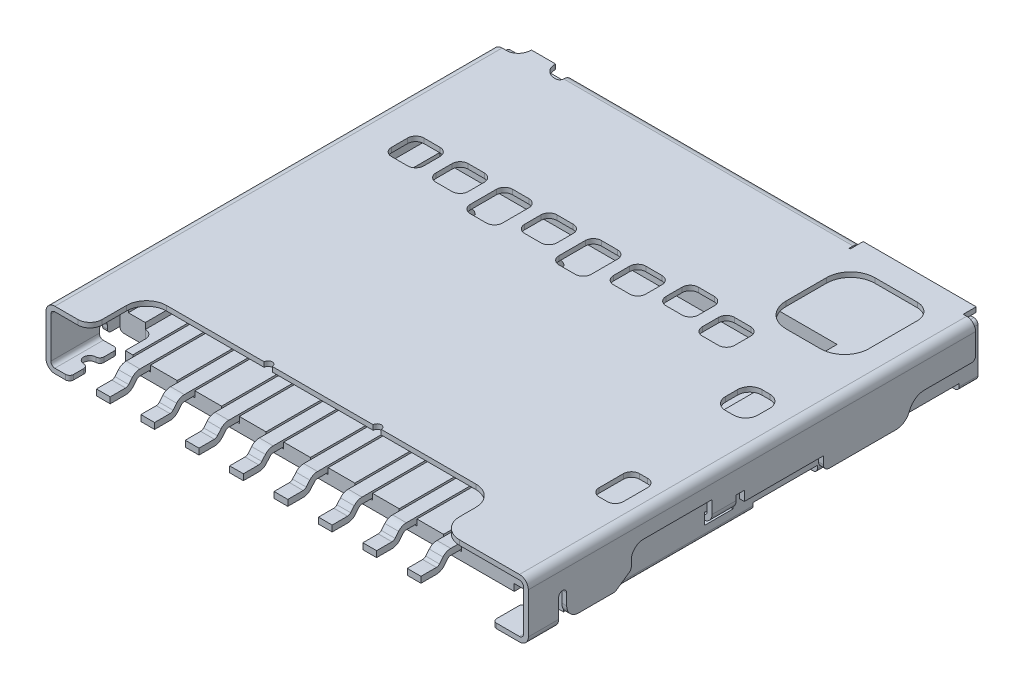
from build123d import *

# Parameters (mm, degrees)
BOSS_EXTRUDE1_DEPTH = 11.08
BOSS_EXTRUDE2_DEPTH = 1.2
CUT_EXTRUDE2_DEPTH  = 1.2
CUT_EXTRUDE3_DEPTH  = 1.2
BOSS_EXTRUDE3_DEPTH = 0.75
CUT_EXTRUDE4_DEPTH  = 0.75
CUT_EXTRUDE5_DEPTH  = 0.75
SKETCH9_W           = 2.8
SKETCH9_H           = 0.320000014
BOSS_EXTRUDE4_DEPTH = 0.12
BOSS_EXTRUDE5_DEPTH = 0.6
CUT_EXTRUDE6_DEPTH  = 0.75
FILLET1_R           = 0.1
BOSS_EXTRUDE6_DEPTH = 7.17
BOSS_EXTRUDE7_DEPTH = 1.2
CUT_EXTRUDE7_DEPTH  = 1.2
CUT_EXTRUDE8_DEPTH  = 1.2
CUT_EXTRUDE9_DEPTH  = 1.2
CUT_EXTRUDE10_DEPTH = 1.2
BOSS_EXTRUDE8_DEPTH = 10.27
SKETCH19_W          = 0.7
SKETCH19_H          = 0.281131807
CUT_EXTRUDE12_DEPTH = 0.5
FILLET2_R           = 0.1
CUT_EXTRUDE13_DEPTH = 0.06
CUT_EXTRUDE14_DEPTH = 0.13
SKETCH22_W          = 2.605000011
SKETCH22_H          = 1.079999998
SKETCH22_W_2        = 2.565
CUT_EXTRUDE15_DEPTH = 0.15
SKETCH23_W          = 1.22
SKETCH23_H          = 0.25
CUT_EXTRUDE16_DEPTH = 0.17
CUT_EXTRUDE17_REACH = 14.95
CUT_EXTRUDE18_DEPTH = 8
SKETCH26_W          = 0.44
SKETCH26_H          = 0.15
CUT_EXTRUDE19_DEPTH = 4.22
BOSS_EXTRUDE9_DEPTH = 0.34
LPATTERN2_COUNT     = 8
LPATTERN2_PITCH     = 1.1


with BuildPart() as part:
    # Sketch1 → Boss-Extrude1 (new body)
    with BuildSketch(Plane.XY):
        with BuildLine():
            Line((4.275, 0.605), (5.755, 0.605))
            ThreePointArc((5.755, 0.605), (5.825710678, 0.575710678), (5.855, 0.505))
            Line((5.855, 0.505), (5.855, -0.505))
            Line((5.855, -0.505), (5.855, -0.614999996))
            Line((5.855, -0.614999996), (5.975, -0.614999996))
            Line((5.975, -0.614999996), (5.975, -0.505))
            Line((5.975, -0.505), (5.975, 0.505))
            ThreePointArc((5.975, 0.505), (5.910563492, 0.660563492), (5.755, 0.725))
            Line((5.755, 0.725), (4.275, 0.725))
            Line((4.275, 0.725), (3.775, 0.725))
            Line((3.775, 0.725), (3.275, 0.725))
            Line((3.275, 0.725), (0.930302692, 0.725))
            Line((0.930302692, 0.725), (0.830302692, 0.725))
            Line((0.830302692, 0.725), (0.730302692, 0.725))
            Line((0.730302692, 0.725), (-1.769697308, 0.725))
            Line((-1.769697308, 0.725), (-1.869697308, 0.725))
            Line((-1.869697308, 0.725), (-1.969697308, 0.725))
            Line((-1.969697308, 0.725), (-4.385, 0.725))
            Line((-4.385, 0.725), (-4.885, 0.725))
            Line((-4.885, 0.725), (-5.185, 0.725))
            Line((-5.185, 0.725), (-5.755, 0.725))
            ThreePointArc((-5.755, 0.725), (-5.910563492, 0.660563492), (-5.975, 0.505))
            Line((-5.975, 0.505), (-5.975, -0.505))
            Line((-5.975, -0.505), (-5.975, -0.615))
            Line((-5.975, -0.615), (-5.855, -0.615))
            Line((-5.855, -0.615), (-5.855, -0.505))
            Line((-5.855, -0.505), (-5.855, 0.505))
            ThreePointArc((-5.855, 0.505), (-5.825710678, 0.575710678), (-5.755, 0.605))
            Line((-5.755, 0.605), (-5.185, 0.605))
            Line((-5.185, 0.605), (-4.885, 0.605))
            Line((-4.885, 0.605), (-4.385, 0.605))
            Line((-4.385, 0.605), (-1.969697308, 0.605))
            Line((-1.969697308, 0.605), (-1.869697308, 0.605))
            Line((-1.869697308, 0.605), (-1.769697308, 0.605))
            Line((-1.769697308, 0.605), (0.730302692, 0.605))
            Line((0.730302692, 0.605), (0.830302692, 0.605))
            Line((0.830302692, 0.605), (0.930302692, 0.605))
            Line((0.930302692, 0.605), (3.275, 0.605))
            Line((3.275, 0.605), (3.775, 0.605))
            Line((3.775, 0.605), (4.275, 0.605))
        make_face()
    extrude(amount=-BOSS_EXTRUDE1_DEPTH)

    # Sketch3 → Boss-Extrude2 (add)
    with BuildSketch(Plane.XY):
        with BuildLine():
            Line((-5.489999995, -0.725), (-5.389999995, -0.725))
            Line((-5.389999995, -0.725), (-5.389999995, -0.605))
            Line((-5.389999995, -0.605), (-5.489999995, -0.605))
            Line((-5.489999995, -0.605), (-5.755, -0.605))
            ThreePointArc((-5.755, -0.605), (-5.825710678, -0.575710678), (-5.855, -0.505))
            Line((-5.855, -0.505), (-5.975, -0.505))
            ThreePointArc((-5.975, -0.505), (-5.910563492, -0.660563492), (-5.755, -0.725))
            Line((-5.755, -0.725), (-5.489999995, -0.725))
        make_face()
    extrude(amount=-BOSS_EXTRUDE2_DEPTH)

    # Sketch4 → Cut-Extrude2 (cut)
    with BuildSketch(Plane.ZY.offset(5.975)):
        with BuildLine():
            Line((-1.2, -0.435), (-1.2, -0.505))
            Line((-1.2, -0.505), (-1.2, -0.745695332))
            Line((-1.2, -0.745695332), (-1.5, -0.745695332))
            Line((-1.5, -0.745695332), (-1.5, -0.615))
            ThreePointArc((-1.5, -0.615), (-1.429289322, -0.585710678), (-1.4, -0.515))
            Line((-1.4, -0.515), (-1.4, -0.435))
            ThreePointArc((-1.4, -0.435), (-1.3, -0.335), (-1.2, -0.435))
        make_face()
    extrude(amount=-CUT_EXTRUDE2_DEPTH, mode=Mode.SUBTRACT)

    # Sketch5 → Cut-Extrude3 (cut)
    with BuildSketch(Plane.XY):
        with BuildLine():
            Line((-5.975, -0.505), (-5.975, -0.725))
            Line((-5.975, -0.725), (-5.755, -0.725))
            ThreePointArc((-5.755, -0.725), (-5.910563492, -0.660563492), (-5.975, -0.505))
        make_face()
    extrude(amount=-CUT_EXTRUDE3_DEPTH, mode=Mode.SUBTRACT)

    # Sketch6 → Boss-Extrude3 (add)
    with BuildSketch(Plane.XY):
        with BuildLine():
            Line((5.755, -0.605), (5.190000003, -0.605))
            Line((5.190000003, -0.605), (5.090000003, -0.605))
            Line((5.090000003, -0.605), (5.090000003, -0.725))
            Line((5.090000003, -0.725), (5.190000003, -0.725))
            Line((5.190000003, -0.725), (5.755, -0.725))
            ThreePointArc((5.755, -0.725), (5.910563492, -0.660563492), (5.975, -0.505))
            Line((5.975, -0.505), (5.855, -0.505))
            ThreePointArc((5.855, -0.505), (5.825710678, -0.575710678), (5.755, -0.605))
        make_face()
    extrude(amount=-BOSS_EXTRUDE3_DEPTH)

    # Sketch7 → Cut-Extrude4 (cut)
    with BuildSketch(Plane(origin=(5.975, 0, 0), x_dir=(0, 0, -1), z_dir=(1, 0, 0))):
        with BuildLine():
            Line((0.75, -0.725), (0.75, -0.505))
            Line((0.75, -0.505), (0.75, -0.034999996))
            ThreePointArc((0.75, -0.034999996), (0.85, 0.065000004), (0.95, -0.034999996))
            Line((0.95, -0.034999996), (0.95, -0.314999996))
            ThreePointArc((0.95, -0.314999996), (1.037867966, -0.52713203), (1.25, -0.614999996))
            Line((1.25, -0.614999996), (2.118477758, -0.614999996))
            ThreePointArc((2.118477758, -0.614999996), (2.148541697, -0.610373785), (2.175823993, -0.596923188))
            Line((2.175823993, -0.596923188), (2.507346216, -0.364857632))
            ThreePointArc((2.507346216, -0.364857632), (2.538697849, -0.329115478), (2.549999981, -0.28293444))
            Line((2.549999981, -0.28293444), (2.549999981, -0.134999995))
            ThreePointArc((2.549999981, -0.134999995), (2.637867947, 0.077132039), (2.849999981, 0.165000005))
            Line((2.849999981, 0.165000005), (4.549999981, 0.165000005))
            Line((4.549999981, 0.165000005), (4.549999981, -0.155))
            Line((4.549999981, -0.155), (5.149999981, -0.155))
            Line((5.149999981, -0.155), (5.149999981, -0.034999995))
            Line((5.149999981, -0.034999995), (5.349999981, -0.034999995))
            Line((5.349999981, -0.034999995), (5.349999981, -0.274999996))
            Line((5.349999981, -0.274999996), (7.310000033, -0.274999996))
            Line((7.310000033, -0.274999996), (7.310000033, -0.464999996))
            ThreePointArc((7.310000033, -0.464999996), (7.353934016, -0.571066013), (7.460000033, -0.614999996))
            Line((7.460000033, -0.614999996), (9.109999974, -0.614999996))
            ThreePointArc((9.109999974, -0.614999996), (9.312072569, -0.550773799), (9.439983139, -0.381666662))
            ThreePointArc((9.439983139, -0.381666662), (9.586166648, -0.188401363), (9.817106756, -0.114999996))
            Line((9.817106756, -0.114999996), (10.979999986, -0.114999996))
            ThreePointArc((10.979999986, -0.114999996), (11.050710664, -0.085710674), (11.079999986, -0.014999996))
            Line((11.079999986, -0.014999996), (11.079999986, -0.725))
            Line((11.079999986, -0.725), (0.75, -0.725))
        make_face()
    extrude(amount=-CUT_EXTRUDE4_DEPTH, mode=Mode.SUBTRACT)

    # Sketch8 → Cut-Extrude5 (cut)
    with BuildSketch(Plane.XY):
        with BuildLine():
            Line((5.975, -0.505), (5.975, -0.725))
            Line((5.975, -0.725), (5.755, -0.725))
            ThreePointArc((5.755, -0.725), (5.910563492, -0.660563492), (5.975, -0.505))
        make_face()
    extrude(amount=-CUT_EXTRUDE5_DEPTH, mode=Mode.SUBTRACT)

    # Sketch9 → Boss-Extrude4 (add)
    with BuildSketch(Plane(origin=(0, 0.725, 0), x_dir=(1, 0, 0), z_dir=(0, 1, 0))):
        with BuildLine():
            Line((2.84, 11.08), (2.84, 11.18))
            Line((2.84, 11.18), (-4.33, 11.18))
            ThreePointArc((-4.33, 11.18), (-4.359289322, 11.109289322), (-4.43, 11.08))
            Line((-4.43, 11.08), (2.84, 11.08))
        make_face()
        with BuildLine():
            Line((-4.75, 11.38), (-4.75, 11.4))
            Line((-4.75, 11.4), (-5.35, 11.4))
            Line((-5.35, 11.4), (-5.35, 11.38))
            ThreePointArc((-5.35, 11.38), (-5.437867966, 11.167867966), (-5.65, 11.08))
            Line((-5.65, 11.08), (-4.45, 11.08))
            ThreePointArc((-4.45, 11.08), (-4.662132034, 11.167867966), (-4.75, 11.38))
        make_face()
        with Locations((4.27, 11.240000007)):
            Rectangle(SKETCH9_W, SKETCH9_H)
    extrude(amount=-BOSS_EXTRUDE4_DEPTH)

    # Sketch10 → Boss-Extrude5 (add)
    with BuildSketch(Plane.XY.offset(-4.549999981)):
        with BuildLine():
            Line((5.755, -0.255), (5.474999999, -0.255))
            Line((5.474999999, -0.255), (5.474999999, -0.375))
            Line((5.474999999, -0.375), (5.755, -0.375))
            ThreePointArc((5.755, -0.375), (5.910563492, -0.310563492), (5.975, -0.155))
            Line((5.975, -0.155), (5.855, -0.155))
            ThreePointArc((5.855, -0.155), (5.825710678, -0.225710678), (5.755, -0.255))
        make_face()
    extrude(amount=-BOSS_EXTRUDE5_DEPTH)

    # Sketch11 → Cut-Extrude6 (cut)
    with BuildSketch(Plane.XZ.offset(0.725)):
        with BuildLine():
            Line((-5.389999995, -1.1), (-5.389999995, -0.85))
            ThreePointArc((-5.389999995, -0.85), (-5.41928931, -0.779289329), (-5.489999975, -0.75))
            ThreePointArc((-5.489999975, -0.75), (-5.596066005, -0.706066024), (-5.639999995, -0.6))
            ThreePointArc((-5.639999995, -0.6), (-5.596066012, -0.493933983), (-5.489999995, -0.45))
            ThreePointArc((-5.489999995, -0.45), (-5.419289317, -0.420710678), (-5.389999995, -0.35))
            Line((-5.389999995, -0.35), (-5.389999995, -0.1))
            ThreePointArc((-5.389999995, -0.1), (-5.419289317, -0.029289322), (-5.489999995, 0))
            Line((-5.489999995, 0), (-5.335838017, 0))
            Line((-5.335838017, 0), (-5.335838017, -1.2))
            Line((-5.335838017, -1.2), (-5.489999995, -1.2))
            ThreePointArc((-5.489999995, -1.2), (-5.419289317, -1.170710678), (-5.389999995, -1.1))
        make_face()
    extrude(amount=-CUT_EXTRUDE6_DEPTH, mode=Mode.SUBTRACT)

    # Fillet1
    fillet1_edges = [part.edges().sort_by_distance(p)[0] for p in [
        (5.090000003, -0.665, -0.75),
        (5.090000003, -0.665, 0),
    ]]
    fillet(fillet1_edges, radius=FILLET1_R)

    # Sketch12 → Boss-Extrude6 (add)
    with BuildSketch(Plane(origin=(2.84, 0, 0), x_dir=(0, 0, -1), z_dir=(1, 0, 0))):
        with BuildLine():
            Line((11.280000014, -0.614999997), (11.400000014, -0.614999997))
            Line((11.400000014, -0.614999997), (11.400000014, -0.505))
            Line((11.400000014, -0.505), (11.400000014, 0.505))
            ThreePointArc((11.400000014, 0.505), (11.335563506, 0.660563492), (11.180000014, 0.725))
            Line((11.180000014, 0.725), (11.180000014, 0.605))
            ThreePointArc((11.180000014, 0.605), (11.250710692, 0.575710678), (11.280000014, 0.505))
            Line((11.280000014, 0.505), (11.280000014, -0.505))
            Line((11.280000014, -0.505), (11.280000014, -0.614999997))
        make_face()
    extrude(amount=-BOSS_EXTRUDE6_DEPTH)

    # Sketch13 → Boss-Extrude7 (add)
    with BuildSketch(Plane(origin=(2.84, 0, 0), x_dir=(0, 0, -1), z_dir=(1, 0, 0))):
        with BuildLine():
            Line((10.700016189, -0.605), (10.700016189, -0.725))
            Line((10.700016189, -0.725), (10.800016189, -0.725))
            Line((10.800016189, -0.725), (11.180016187, -0.725))
            ThreePointArc((11.180016187, -0.725), (11.335579679, -0.660563492), (11.400016187, -0.505))
            Line((11.400016187, -0.505), (11.280016187, -0.505))
            ThreePointArc((11.280016187, -0.505), (11.250726865, -0.575710678), (11.180016187, -0.605))
            Line((11.180016187, -0.605), (10.800016189, -0.605))
            Line((10.800016189, -0.605), (10.700016189, -0.605))
        make_face()
    boss_extrude7 = extrude(amount=-BOSS_EXTRUDE7_DEPTH)

    # Sketch14 → Cut-Extrude7 (cut)
    with BuildSketch(Plane(origin=(2.84, 0, 0), x_dir=(0, 0, -1), z_dir=(1, 0, 0))):
        with BuildLine():
            Line((11.400000014, -0.725), (11.400000014, -0.614999997))
            Line((11.400000014, -0.614999997), (11.370541778, -0.614999997))
            ThreePointArc((11.370541778, -0.614999997), (11.290016189, -0.695525588), (11.180016187, -0.725))
            Line((11.180016187, -0.725), (11.400000014, -0.725))
        make_face()
        with BuildLine():
            Line((11.400000014, -0.614999997), (11.400000014, -0.507667555))
            ThreePointArc((11.400000014, -0.507667555), (11.392170751, -0.563227495), (11.370541778, -0.614999997))
            Line((11.370541778, -0.614999997), (11.400000014, -0.614999997))
        make_face()
    cut_extrude7 = extrude(amount=-CUT_EXTRUDE7_DEPTH, mode=Mode.SUBTRACT)

    # Sketch15 → Cut-Extrude8 (cut)
    with BuildSketch(Plane.XZ.offset(0.725)):
        with BuildLine():
            Line((2.74, -10.700000016), (2.49, -10.700000016))
            ThreePointArc((2.49, -10.700000016), (2.419289322, -10.729289338), (2.39, -10.800000016))
            Line((2.39, -10.800000016), (2.39, -10.850000016))
            ThreePointArc((2.39, -10.850000016), (2.346066017, -10.956066033), (2.24, -11.000000016))
            ThreePointArc((2.24, -11.000000016), (2.133933983, -10.956066033), (2.09, -10.850000016))
            Line((2.09, -10.850000016), (2.09, -10.800000016))
            ThreePointArc((2.09, -10.800000016), (2.060710678, -10.729289338), (1.99, -10.700000016))
            Line((1.99, -10.700000016), (1.74, -10.700000016))
            ThreePointArc((1.74, -10.700000016), (1.669289322, -10.729289338), (1.64, -10.800000016))
            Line((1.64, -10.800000016), (1.64, -10.618683905))
            Line((1.64, -10.618683905), (2.84, -10.618683905))
            Line((2.84, -10.618683905), (2.84, -10.800000016))
            ThreePointArc((2.84, -10.800000016), (2.810710678, -10.729289338), (2.74, -10.700000016))
        make_face()
    cut_extrude8 = extrude(amount=-CUT_EXTRUDE8_DEPTH, mode=Mode.SUBTRACT)

    # Mirror1: Boss-Extrude7, Cut-Extrude7, Cut-Extrude8 across plane
    add(boss_extrude7.mirror(Plane(origin=(-0.745, 0, 0), x_dir=(0, 0, 1), z_dir=(1, 0, 0))))
    add(cut_extrude7.mirror(Plane(origin=(-0.745, 0, 0), x_dir=(0, 0, 1), z_dir=(1, 0, 0))), mode=Mode.SUBTRACT)
    add(cut_extrude8.mirror(Plane(origin=(-0.745, 0, 0), x_dir=(0, 0, 1), z_dir=(1, 0, 0))), mode=Mode.SUBTRACT)

    # Sketch16 → Cut-Extrude9 (cut)
    with BuildSketch(Plane(origin=(0, 0, -11.400000014), x_dir=(-1, 0, 0), z_dir=(0, 0, -1))):
        with BuildLine():
            Line((-1.64, -0.725), (-1.64, -0.505))
            Line((-1.64, -0.505), (-1.64, 0.105000003))
            Line((-1.64, 0.105000003), (-0.755, 0.105000003))
            Line((-0.755, 0.105000003), (-0.755, -0.414999997))
            ThreePointArc((-0.755, -0.414999997), (-0.696421356, -0.556421353), (-0.555, -0.614999997))
            Line((-0.555, -0.614999997), (2.045, -0.614999997))
            ThreePointArc((2.045, -0.614999997), (2.186421356, -0.556421353), (2.245, -0.414999997))
            Line((2.245, -0.414999997), (2.245, 0.105000003))
            Line((2.245, 0.105000003), (3.13, 0.105000003))
            Line((3.13, 0.105000003), (3.13, -0.505))
            Line((3.13, -0.505), (3.13, -0.725))
            Line((3.13, -0.725), (-1.64, -0.725))
        make_face()
    extrude(amount=-CUT_EXTRUDE9_DEPTH, mode=Mode.SUBTRACT)

    # Sketch17 → Cut-Extrude10 (cut)
    with BuildSketch(Plane(origin=(0, 0.725, 0), x_dir=(1, 0, 0), z_dir=(0, 1, 0))):
        with BuildLine():
            Line((-4.885, 0.3), (-4.885, 0.9))
            ThreePointArc((-4.885, 0.9), (-4.738553391, 1.253553391), (-4.385, 1.4))
            Line((-4.385, 1.4), (-1.969697308, 1.4))
            ThreePointArc((-1.969697308, 1.4), (-1.940407986, 1.470710678), (-1.869697308, 1.5))
            ThreePointArc((-1.869697308, 1.5), (-1.79898663, 1.470710678), (-1.769697308, 1.4))
            Line((-1.769697308, 1.4), (0.730302692, 1.4))
            ThreePointArc((0.730302692, 1.4), (0.759592014, 1.470710678), (0.830302692, 1.5))
            ThreePointArc((0.830302692, 1.5), (0.90101337, 1.470710678), (0.930302692, 1.4))
            Line((0.930302692, 1.4), (3.275, 1.4))
            ThreePointArc((3.275, 1.4), (3.628553391, 1.253553391), (3.775, 0.9))
            Line((3.775, 0.9), (3.775, 0.5))
            ThreePointArc((3.775, 0.5), (3.921446609, 0.146446609), (4.275, 0))
            Line((4.275, 0), (-5.185, 0))
            ThreePointArc((-5.185, 0), (-4.972867966, 0.087867966), (-4.885, 0.3))
        make_face()
        with BuildLine():
            Line((1.304999989, 7.58000003), (1.304999989, 7.98000003))
            ThreePointArc((1.304999989, 7.98000003), (1.246421345, 8.121421387), (1.104999989, 8.18000003))
            Line((1.104999989, 8.18000003), (0.704999989, 8.18000003))
            ThreePointArc((0.704999989, 8.18000003), (0.563578633, 8.121421387), (0.504999989, 7.98000003))
            Line((0.504999989, 7.98000003), (0.504999989, 7.58000003))
            ThreePointArc((0.504999989, 7.58000003), (0.563578633, 7.438578674), (0.704999989, 7.38000003))
            Line((0.704999989, 7.38000003), (1.104999989, 7.38000003))
            ThreePointArc((1.104999989, 7.38000003), (1.246421345, 7.438578674), (1.304999989, 7.58000003))
        make_face()
        with BuildLine():
            Line((0.004999989, 8.18000003), (-0.395000011, 8.18000003))
            ThreePointArc((-0.395000011, 8.18000003), (-0.536421367, 8.121421387), (-0.595000011, 7.98000003))
            Line((-0.595000011, 7.98000003), (-0.595000011, 7.33000003))
            ThreePointArc((-0.595000011, 7.33000003), (-0.536421367, 7.188578674), (-0.395000011, 7.13000003))
            Line((-0.395000011, 7.13000003), (0.004999989, 7.13000003))
            ThreePointArc((0.004999989, 7.13000003), (0.146421345, 7.188578674), (0.204999989, 7.33000003))
            Line((0.204999989, 7.33000003), (0.204999989, 7.98000003))
            ThreePointArc((0.204999989, 7.98000003), (0.146421345, 8.121421387), (0.004999989, 8.18000003))
        make_face()
        with BuildLine():
            Line((2.404999989, 7.780000046), (2.404999989, 8.180000046))
            ThreePointArc((2.404999989, 8.180000046), (2.346421345, 8.321421402), (2.204999989, 8.380000046))
            Line((2.204999989, 8.380000046), (1.804999989, 8.380000046))
            ThreePointArc((1.804999989, 8.380000046), (1.663578633, 8.321421402), (1.604999989, 8.180000046))
            Line((1.604999989, 8.180000046), (1.604999989, 7.780000046))
            ThreePointArc((1.604999989, 7.780000046), (1.663578633, 7.63857869), (1.804999989, 7.580000046))
            Line((1.804999989, 7.580000046), (2.204999989, 7.580000046))
            ThreePointArc((2.204999989, 7.580000046), (2.346421345, 7.63857869), (2.404999989, 7.780000046))
        make_face()
        with BuildLine():
            Line((3.304999989, 8.18000003), (2.904999989, 8.18000003))
            ThreePointArc((2.904999989, 8.18000003), (2.763578633, 8.121421387), (2.704999989, 7.98000003))
            Line((2.704999989, 7.98000003), (2.704999989, 7.58000003))
            ThreePointArc((2.704999989, 7.58000003), (2.763578633, 7.438578674), (2.904999989, 7.38000003))
            Line((2.904999989, 7.38000003), (3.304999989, 7.38000003))
            ThreePointArc((3.304999989, 7.38000003), (3.446421345, 7.438578674), (3.504999989, 7.58000003))
            Line((3.504999989, 7.58000003), (3.504999989, 7.98000003))
            ThreePointArc((3.504999989, 7.98000003), (3.446421345, 8.121421387), (3.304999989, 8.18000003))
        make_face()
        with BuildLine():
            Line((5.24, 9.17), (5.24, 10.37))
            ThreePointArc((5.24, 10.37), (5.122842712, 10.652842712), (4.84, 10.77))
            Line((4.84, 10.77), (3.79, 10.77))
            ThreePointArc((3.79, 10.77), (3.365735931, 10.594264069), (3.19, 10.17))
            Line((3.19, 10.17), (3.19, 9.17))
            ThreePointArc((3.19, 9.17), (3.365735931, 8.745735931), (3.79, 8.57))
            Line((3.79, 8.57), (4.64, 8.57))
            ThreePointArc((4.64, 8.57), (5.064264069, 8.745735931), (5.24, 9.17))
        make_face()
        with BuildLine():
            Line((4.79, 6.07), (4.99, 6.07))
            ThreePointArc((4.99, 6.07), (5.202132034, 6.157867966), (5.29, 6.37))
            Line((5.29, 6.37), (5.29, 6.67))
            ThreePointArc((5.29, 6.67), (5.202132034, 6.882132034), (4.99, 6.97))
            Line((4.99, 6.97), (4.79, 6.97))
            ThreePointArc((4.79, 6.97), (4.577867966, 6.882132034), (4.49, 6.67))
            Line((4.49, 6.67), (4.49, 6.37))
            ThreePointArc((4.49, 6.37), (4.577867966, 6.157867966), (4.79, 6.07))
        make_face()
        with BuildLine():
            Line((5.08, 2.65), (5.28, 2.65))
            ThreePointArc((5.28, 2.65), (5.421421356, 2.708578644), (5.48, 2.85))
            Line((5.48, 2.85), (5.48, 3.45))
            ThreePointArc((5.48, 3.45), (5.421421356, 3.591421356), (5.28, 3.65))
            Line((5.28, 3.65), (5.08, 3.65))
            ThreePointArc((5.08, 3.65), (4.938578644, 3.591421356), (4.88, 3.45))
            Line((4.88, 3.45), (4.88, 2.85))
            ThreePointArc((4.88, 2.85), (4.938578644, 2.708578644), (5.08, 2.65))
        make_face()
        with BuildLine():
            Line((-4.795000011, 7.38000003), (-4.395000011, 7.38000003))
            ThreePointArc((-4.395000011, 7.38000003), (-4.253578655, 7.438578674), (-4.195000011, 7.58000003))
            Line((-4.195000011, 7.58000003), (-4.195000011, 7.98000003))
            ThreePointArc((-4.195000011, 7.98000003), (-4.253578655, 8.121421387), (-4.395000011, 8.18000003))
            Line((-4.395000011, 8.18000003), (-4.795000011, 8.18000003))
            ThreePointArc((-4.795000011, 8.18000003), (-4.936421367, 8.121421387), (-4.995000011, 7.98000003))
            Line((-4.995000011, 7.98000003), (-4.995000011, 7.58000003))
            ThreePointArc((-4.995000011, 7.58000003), (-4.936421367, 7.438578674), (-4.795000011, 7.38000003))
        make_face()
        with BuildLine():
            Line((-1.095000011, 8.18000003), (-1.495000011, 8.18000003))
            ThreePointArc((-1.495000011, 8.18000003), (-1.636421367, 8.121421387), (-1.695000011, 7.98000003))
            Line((-1.695000011, 7.98000003), (-1.695000011, 7.58000003))
            ThreePointArc((-1.695000011, 7.58000003), (-1.636421367, 7.438578674), (-1.495000011, 7.38000003))
            Line((-1.495000011, 7.38000003), (-1.095000011, 7.38000003))
            ThreePointArc((-1.095000011, 7.38000003), (-0.953578655, 7.438578674), (-0.895000011, 7.58000003))
            Line((-0.895000011, 7.58000003), (-0.895000011, 7.98000003))
            ThreePointArc((-0.895000011, 7.98000003), (-0.953578655, 8.121421387), (-1.095000011, 8.18000003))
        make_face()
        with BuildLine():
            Line((-2.195000011, 8.18000003), (-2.595000011, 8.18000003))
            ThreePointArc((-2.595000011, 8.18000003), (-2.736421367, 8.121421387), (-2.795000011, 7.98000003))
            Line((-2.795000011, 7.98000003), (-2.795000011, 7.33000003))
            ThreePointArc((-2.795000011, 7.33000003), (-2.736421367, 7.188578674), (-2.595000011, 7.13000003))
            Line((-2.595000011, 7.13000003), (-2.195000011, 7.13000003))
            ThreePointArc((-2.195000011, 7.13000003), (-2.053578655, 7.188578674), (-1.995000011, 7.33000003))
            Line((-1.995000011, 7.33000003), (-1.995000011, 7.98000003))
            ThreePointArc((-1.995000011, 7.98000003), (-2.053578655, 8.121421387), (-2.195000011, 8.18000003))
        make_face()
        with BuildLine():
            Line((-3.295000011, 8.18000003), (-3.695000011, 8.18000003))
            ThreePointArc((-3.695000011, 8.18000003), (-3.836421367, 8.121421387), (-3.895000011, 7.98000003))
            Line((-3.895000011, 7.98000003), (-3.895000011, 7.58000003))
            ThreePointArc((-3.895000011, 7.58000003), (-3.836421367, 7.438578674), (-3.695000011, 7.38000003))
            Line((-3.695000011, 7.38000003), (-3.295000011, 7.38000003))
            ThreePointArc((-3.295000011, 7.38000003), (-3.153578655, 7.438578674), (-3.095000011, 7.58000003))
            Line((-3.095000011, 7.58000003), (-3.095000011, 7.98000003))
            ThreePointArc((-3.095000011, 7.98000003), (-3.153578655, 8.121421387), (-3.295000011, 8.18000003))
        make_face()
    extrude(amount=-CUT_EXTRUDE10_DEPTH, mode=Mode.SUBTRACT)


with BuildPart() as body_2:
    # Sketch18 → Boss-Extrude8 (new body)
    with BuildSketch(Plane.XY.offset(-11.270000014)):
        with BuildLine():
            Line((-5.205000011, 0.595), (-5.745, 0.595))
            ThreePointArc((-5.745, 0.595), (-5.815710678, 0.565710678), (-5.845, 0.495))
            Line((-5.845, 0.495), (-5.845, -0.585))
            Line((-5.845, -0.585), (-5.845, -0.705))
            Line((-5.845, -0.705), (5.845, -0.705))
            Line((5.845, -0.705), (5.845, -0.585))
            Line((5.845, -0.585), (5.845, 0.495))
            ThreePointArc((5.845, 0.495), (5.815710678, 0.565710678), (5.745, 0.595))
            Line((5.745, 0.595), (3.735, 0.595))
            Line((3.735, 0.595), (-5.205000011, 0.595))
        make_face()
    extrude(amount=BOSS_EXTRUDE8_DEPTH)

    # Sketch19 → Cut-Extrude12 (cut)
    with BuildSketch(Plane(origin=(5.845, 0, 0), x_dir=(0, 0, -1), z_dir=(1, 0, 0))):
        with Locations((4.849999981, -0.284434097)):
            Rectangle(SKETCH19_W, SKETCH19_H)
    extrude(amount=-CUT_EXTRUDE12_DEPTH, mode=Mode.SUBTRACT)

    # Fillet2
    fillet2_edges = [body_2.edges().sort_by_distance(p)[0] for p in [
        (0, -0.705, -11.270000014),
        (5.845, -0.705, -6.135000014),
        (-5.845, -0.705, -6.135000014),
    ]]
    fillet(fillet2_edges, radius=FILLET2_R)

    # Sketch20 → Cut-Extrude13 (cut)
    with BuildSketch(Plane.XZ.offset(0.705)):
        Polygon((-5.205000011, -10.190000016), (-5.205000011, -11.270000014), (-2.6, -11.270000014), (1.17, -11.270000014), (3.735, -11.270000014), (3.735, -10.190000016), (3.735, -8.384355974), (3.735, -4.440000007), (-5.205000011, -4.440000007), (-5.205000011, -8.210000016), align=None)
    extrude(amount=-CUT_EXTRUDE13_DEPTH, mode=Mode.SUBTRACT)

    # Sketch21 → Cut-Extrude14 (cut)
    with BuildSketch(Plane.XZ.offset(0.645)):
        with BuildLine():
            Line((-5.205000011, -4.440000007), (-5.205000011, -8.210000016))
            ThreePointArc((-5.205000011, -8.210000016), (-5.087842724, -8.492842729), (-4.805000011, -8.610000016))
            Line((-4.805000011, -8.610000016), (3.375, -8.610000016))
            ThreePointArc((3.375, -8.610000016), (3.587435422, -8.548926545), (3.735, -8.384355974))
            Line((3.735, -8.384355974), (3.735, -4.440000007))
            Line((3.735, -4.440000007), (-5.205000011, -4.440000007))
        make_face()
    extrude(amount=-CUT_EXTRUDE14_DEPTH, mode=Mode.SUBTRACT)

    # Sketch22 → Cut-Extrude15 (cut)
    with BuildSketch(Plane.XZ.offset(0.645)):
        with Locations((-3.902500006, -10.730000015)):
            Rectangle(SKETCH22_W, SKETCH22_H)
        with Locations((2.4525, -10.730000015)):
            Rectangle(SKETCH22_W_2, SKETCH22_H)
    extrude(amount=-CUT_EXTRUDE15_DEPTH, mode=Mode.SUBTRACT)

    # Sketch23 → Cut-Extrude16 (cut)
    with BuildSketch(Plane.XZ.offset(0.705)):
        with BuildLine():
            Line((5.845, -9.399999989), (5.180000002, -9.399999989))
            ThreePointArc((5.180000002, -9.399999989), (5.003223307, -9.473223294), (4.930000002, -9.649999989))
            Line((4.930000002, -9.649999989), (4.930000002, -10.549999989))
            ThreePointArc((4.930000002, -10.549999989), (5.003223307, -10.726776685), (5.180000002, -10.799999989))
            Line((5.180000002, -10.799999989), (5.845, -10.799999989))
            Line((5.845, -10.799999989), (5.845, -9.399999989))
        make_face()
        Polygon((5.845, -5.700000047), (4.855000002, -5.700000047), (4.855000002, -6.250000052), (4.445, -6.250000052), (4.445, -10.790000014), (4.675, -10.790000014), (4.835000002, -7.800000052), (4.835000002, -7.290000047), (5.845, -7.290000047), align=None)
        with Locations((5.235, -1.125000014)):
            Rectangle(SKETCH23_W, SKETCH23_H)
    extrude(amount=-CUT_EXTRUDE16_DEPTH, mode=Mode.SUBTRACT)

    # Cut-Extrude17: up to this face of the body (flat: up to its plane)
    cut_extrude17_end = Plane(body_2.part.faces().sort_by_distance((0, 0.595, -6.135000014))[0])
    # Sketch24 → Cut-Extrude17 (cut, up to the picked face)
    with BuildSketch(Plane.XZ.offset(0.705), mode=Mode.PRIVATE) as cut_extrude17_sk1:
        with BuildLine():
            Line((-5.21, -1.700000014), (-5.845, -1.700000014))
            Line((-5.845, -1.700000014), (-5.845, -1.000000014))
            Line((-5.845, -1.000000014), (-5.01, -1.000000014))
            Line((-5.01, -1.000000014), (-5.01, -1.500000014))
            ThreePointArc((-5.01, -1.500000014), (-5.068578644, -1.64142137), (-5.21, -1.700000014))
        make_face()
    cut_extrude17_tool1 = split(extrude(cut_extrude17_sk1.sketch, amount=-CUT_EXTRUDE17_REACH, mode=Mode.PRIVATE), bisect_by=cut_extrude17_end, keep=Keep.BOTH, mode=Mode.PRIVATE)
    add(cut_extrude17_tool1.solids().sort_by(Axis((-5.433057, -0.705, -1.345449), (0, 1, 0)))[0], mode=Mode.SUBTRACT)

    # Sketch25 → Cut-Extrude18 (cut)
    with BuildSketch(Plane.XY.offset(-1.000000014)):
        with BuildLine():
            Line((-5.635, 0.595), (-5.635, -0.205))
            Line((-5.635, -0.205), (-5.215000011, -0.205))
            Line((-5.215000011, -0.205), (-5.215000011, -0.355))
            Line((-5.215000011, -0.355), (4.475, -0.355))
            ThreePointArc((4.475, -0.355), (4.581066017, -0.311066017), (4.625, -0.205))
            Line((4.625, -0.205), (4.625, 0.595))
            Line((4.625, 0.595), (-5.635, 0.595))
        make_face()
    extrude(amount=-CUT_EXTRUDE18_DEPTH, mode=Mode.SUBTRACT)

    # Sketch26 → Cut-Extrude19 (cut)
    with BuildSketch(Plane.XY.offset(-1.000000014)):
        with Locations((-4.605, -0.43)):
            Rectangle(SKETCH26_W, SKETCH26_H)
        with Locations((-3.505, -0.43)):
            Rectangle(SKETCH26_W, SKETCH26_H)
        with Locations((-2.405, -0.43)):
            Rectangle(SKETCH26_W, SKETCH26_H)
        with Locations((-1.305, -0.43)):
            Rectangle(SKETCH26_W, SKETCH26_H)
        with Locations((-0.205, -0.43)):
            Rectangle(SKETCH26_W, SKETCH26_H)
        with Locations((0.895, -0.43)):
            Rectangle(SKETCH26_W, SKETCH26_H)
        with Locations((1.995, -0.43)):
            Rectangle(SKETCH26_W, SKETCH26_H)
        with Locations((3.095, -0.43)):
            Rectangle(SKETCH26_W, SKETCH26_H)
    extrude(amount=-CUT_EXTRUDE19_DEPTH, mode=Mode.SUBTRACT)


with BuildPart() as body_3:
    # Sketch27 → Boss-Extrude9 (new body)
    with BuildSketch(Plane(origin=(-4.775, 0, 0), x_dir=(0, 0, -1), z_dir=(1, 0, 0))):
        with BuildLine():
            Line((0.050000014, -0.585), (0.050000014, -0.735))
            Line((0.050000014, -0.735), (0.430934686, -0.735))
            ThreePointArc((0.430934686, -0.735), (0.536589251, -0.711576947), (0.622445797, -0.645696902))
            Line((0.622445797, -0.645696902), (0.710530837, -0.540721239))
            ThreePointArc((0.710530837, -0.540721239), (0.744873455, -0.514369221), (0.787135281, -0.505))
            Line((0.787135281, -0.505), (2.850525852, -0.505))
            ThreePointArc((2.850525852, -0.505), (3.293262634, -0.495339449), (3.735156641, -0.466376186))
            Line((3.735156641, -0.466376186), (7.139891908, -0.168500447))
            ThreePointArc((7.139891908, -0.168500447), (7.390519481, -0.118047578), (7.623807259, -0.01346993))
            ThreePointArc((7.623807259, -0.01346993), (7.758147522, -0.004406771), (7.845635244, -0.106755906))
            Line((7.845635244, -0.106755906), (7.99595912, -0.093604271))
            ThreePointArc((7.99595912, -0.093604271), (7.894007685, 0.08614755), (7.700000014, 0.157322237))
            ThreePointArc((7.700000014, 0.157322237), (7.621021219, 0.146739496), (7.547614504, 0.115737903))
            ThreePointArc((7.547614504, 0.115737903), (7.344755566, 0.024800818), (7.126818547, -0.019071243))
            Line((7.126818547, -0.019071243), (3.72208328, -0.316946981))
            ThreePointArc((3.72208328, -0.316946981), (3.286719726, -0.345482216), (2.850525852, -0.355))
            Line((2.850525852, -0.355), (0.787135281, -0.355))
            ThreePointArc((0.787135281, -0.355), (0.681480716, -0.378423053), (0.59562417, -0.444303098))
            Line((0.59562417, -0.444303098), (0.50753913, -0.549278761))
            ThreePointArc((0.50753913, -0.549278761), (0.473196512, -0.575630779), (0.430934686, -0.585))
            Line((0.430934686, -0.585), (0.050000014, -0.585))
        make_face()
    extrude(amount=BOSS_EXTRUDE9_DEPTH)


with BuildPart() as lpattern2_1:
    # LPattern2: pattern copy
    add(body_3.part.moved(Location(Vector(1, 0, 0) * (1 * LPATTERN2_PITCH))))


with BuildPart() as lpattern2_2:
    # LPattern2: pattern copy
    add(body_3.part.moved(Location(Vector(1, 0, 0) * (2 * LPATTERN2_PITCH))))


with BuildPart() as lpattern2_3:
    # LPattern2: pattern copy
    add(body_3.part.moved(Location(Vector(1, 0, 0) * (3 * LPATTERN2_PITCH))))


with BuildPart() as lpattern2_4:
    # LPattern2: pattern copy
    add(body_3.part.moved(Location(Vector(1, 0, 0) * (4 * LPATTERN2_PITCH))))


with BuildPart() as lpattern2_5:
    # LPattern2: pattern copy
    add(body_3.part.moved(Location(Vector(1, 0, 0) * (5 * LPATTERN2_PITCH))))


with BuildPart() as lpattern2_6:
    # LPattern2: pattern copy
    add(body_3.part.moved(Location(Vector(1, 0, 0) * (6 * LPATTERN2_PITCH))))


with BuildPart() as lpattern2_7:
    # LPattern2: pattern copy
    add(body_3.part.moved(Location(Vector(1, 0, 0) * (7 * LPATTERN2_PITCH))))


solid = Compound([part.part, body_2.part, body_3.part, lpattern2_1.part, lpattern2_2.part, lpattern2_3.part, lpattern2_4.part, lpattern2_5.part, lpattern2_6.part, lpattern2_7.part])
